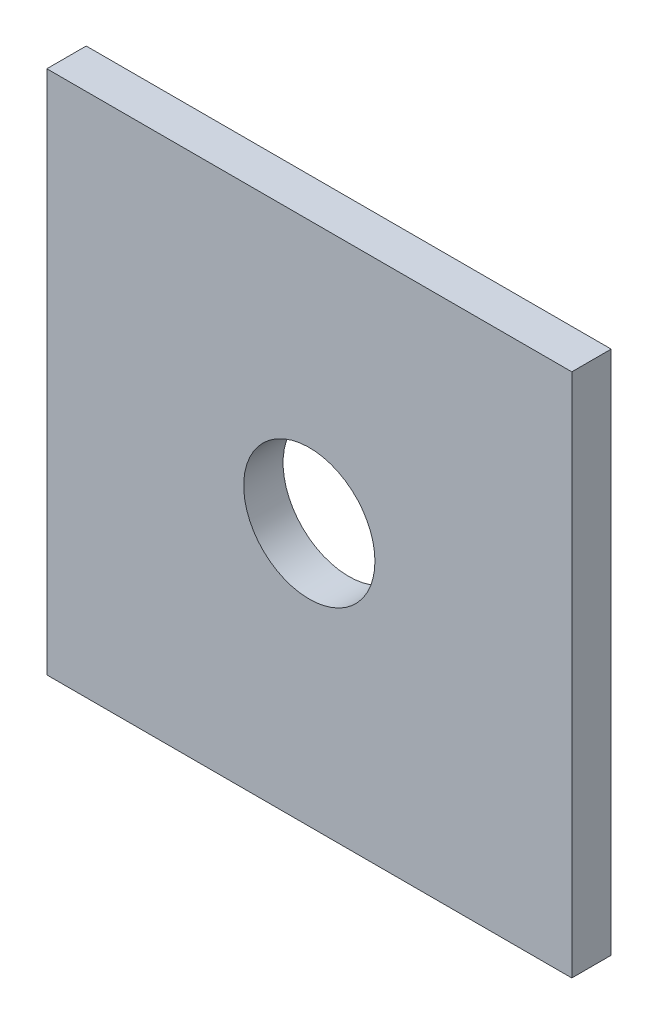
from build123d import *

# Parameters (mm, degrees)
CROQUIS1_W              = 40
CROQUIS1_H              = 40
CROQUIS1_R              = 5
SALIENTE_EXTRUIR1_DEPTH = 3


with BuildPart() as part:
    # Croquis1 → Saliente-Extruir1 (new body)
    with BuildSketch(Plane.XY):
        Rectangle(CROQUIS1_W, CROQUIS1_H)
        Circle(CROQUIS1_R, mode=Mode.SUBTRACT)
    extrude(amount=SALIENTE_EXTRUIR1_DEPTH)


solid = part.part
